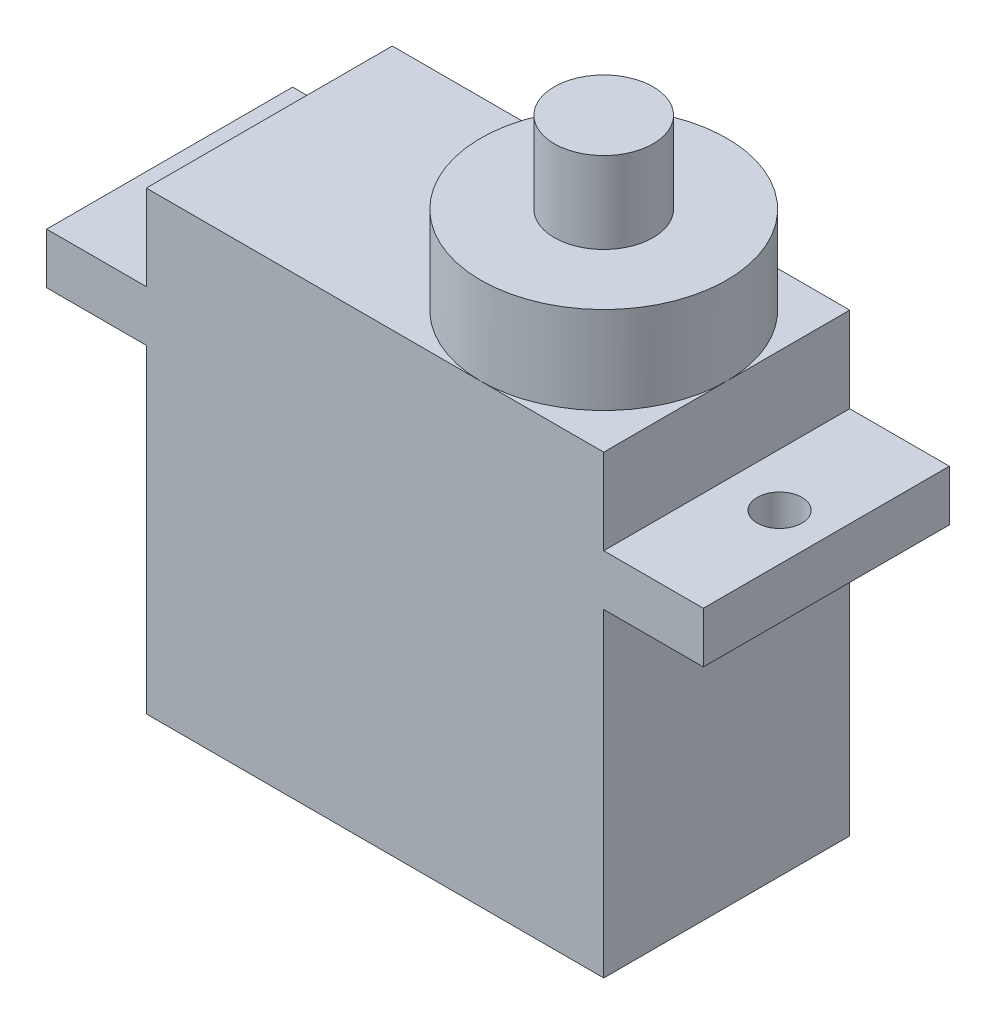
from build123d import *

# Parameters (mm, degrees)
EXTRUDE_1_DEPTH     = 12.1
SKETCH_3_R          = 6.05
EXTRUDE_2_DEPTH     = 4.3
SKETCH_4_R          = 2.43
EXTRUDE_3_DEPTH     = 4
SKETCH_5_R          = 1.1
CUT_EXTRUDE_1_DEPTH = 4


with BuildPart() as part:
    # Эскиз1 → Бобышка-Вытянуть1 (new body)
    with BuildSketch(Plane.XY):
        Polygon((0, 0), (22.5, 0), (22.5, 15.7), (27.4, 15.7), (27.4, 18.2), (22.5, 18.2), (22.5, 22.4), (0, 22.4), (0, 18.2), (-4.9, 18.2), (-4.9, 15.7), (0, 15.7), align=None)
    extrude(amount=EXTRUDE_1_DEPTH)

    # Эскиз3 → Бобышка-Вытянуть2 (add)
    with BuildSketch(Plane(origin=(0, 22.4, 0), x_dir=(1, 0, 0), z_dir=(0, 1, 0))):
        with Locations(Location((16.45, -6.05, 0), (0, 0, 270))):
            Circle(SKETCH_3_R)
    extrude(amount=EXTRUDE_2_DEPTH)

    # Эскиз4 → Бобышка-Вытянуть3 (add)
    with BuildSketch(Plane(origin=(0, 26.7, 0), x_dir=(1, 0, 0), z_dir=(0, 1, 0))):
        with Locations(Location((16.45, -6.05, 0), (0, 0, 270))):
            Circle(SKETCH_4_R)
    extrude(amount=EXTRUDE_3_DEPTH)

    # Эскиз5 → Вырез-Вытянуть1 (cut)
    with BuildSketch(Plane(origin=(0, 18.2, 0), x_dir=(1, 0, 0), z_dir=(0, 1, 0))):
        with Locations(Location((25.1, -6.05, 0), (0, 0, 270))):
            Circle(SKETCH_5_R)
        with Locations(Location((-2.6, -6.05, 0), (0, 0, 270))):
            Circle(SKETCH_5_R)
    extrude(amount=-CUT_EXTRUDE_1_DEPTH, mode=Mode.SUBTRACT)


solid = part.part
